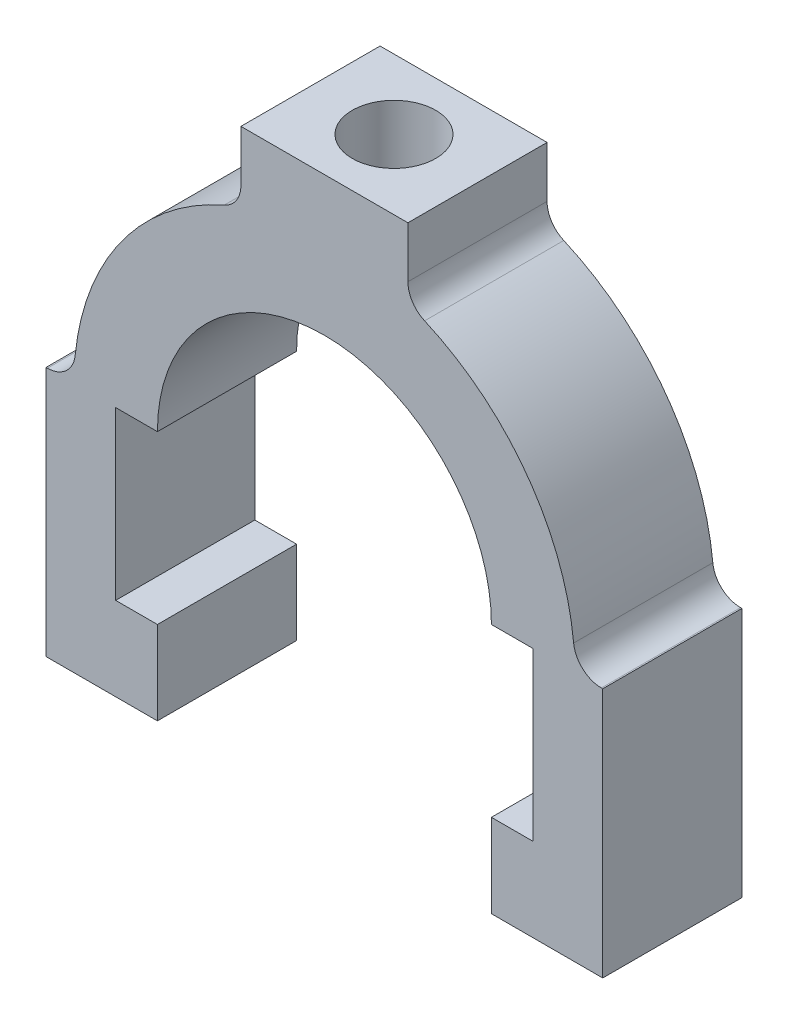
from build123d import *

# Parameters (mm, degrees)
EXTRUDE_3_DEPTH     = 10
SKETCH_3_R          = 6
CUT_EXTRUDE_1_DEPTH = 91
FILLET_1_R          = 4


with BuildPart() as part:
    # 스케치1 → 보스-돌출3 (new, symmetric)
    with BuildSketch(Plane.XY):
        with BuildLine():
            Line((-12, 80), (12, 80))
            Line((12, 80), (12, 69.941125497))
            ThreePointArc((12, 69.941125497), (29.393876913, 56.784609691), (36, 36))
            Line((36, 36), (40, 36))
            Line((40, 36), (40, 0))
            Line((40, 0), (24, 0))
            Line((24, 0), (24, 12))
            Line((24, 12), (30, 12))
            Line((30, 12), (30, 36))
            Line((30, 36), (24, 36))
            ThreePointArc((24, 36), (0, 60), (-24, 36))
            Line((-24, 36), (-30, 36))
            Line((-30, 36), (-30, 12))
            Line((-30, 12), (-24, 12))
            Line((-24, 12), (-24, 0))
            Line((-24, 0), (-40, 0))
            Line((-40, 0), (-40, 36))
            Line((-40, 36), (-36, 36))
            ThreePointArc((-36, 36), (-29.393876913, 56.784609691), (-12, 69.941125497))
            Line((-12, 69.941125497), (-12, 80))
        make_face()
    extrude(amount=EXTRUDE_3_DEPTH, both=True)

    # 스케치3 → 컷-돌출1 (cut, through all)
    with BuildSketch(Plane(origin=(0, 80, 0), x_dir=(1, 0, 0), z_dir=(0, 1, 0))):
        with Locations(Location((0, 0, 0), (0, 0, 270))):
            Circle(SKETCH_3_R)
    extrude(amount=-CUT_EXTRUDE_1_DEPTH, mode=Mode.SUBTRACT)

    # 필렛1
    fillet_1_edges = [part.edges().sort_by_distance(p)[0] for p in [
        (-36, 36, 0),
        (-12, 69.941125497, 0),
        (12, 69.941125497, 0),
        (36, 36, 0),
    ]]
    fillet(fillet_1_edges, radius=FILLET_1_R)


solid = part.part
